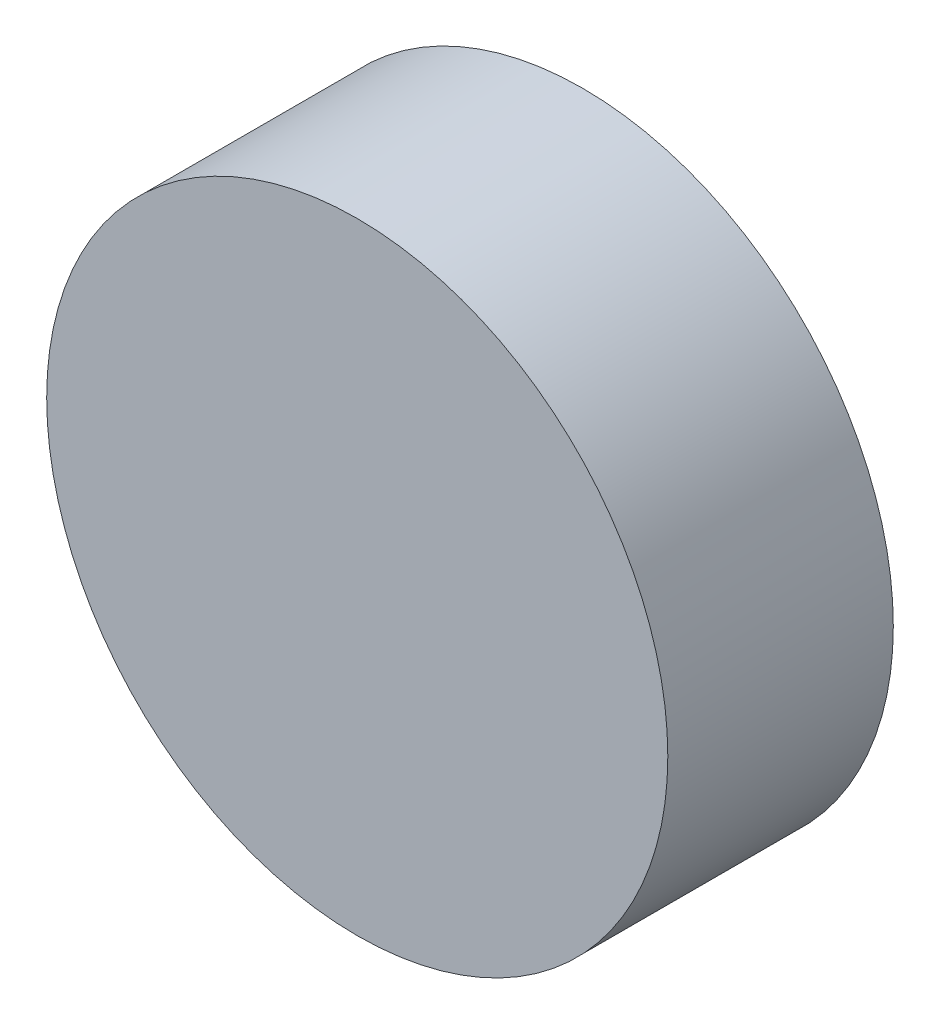
from build123d import *

# Parameters (mm, degrees)
SKETCH1_R           = 23
BOSS_EXTRUDE1_DEPTH = 16.7


with BuildPart() as part:
    # Sketch1 → Boss-Extrude1 (new body)
    with BuildSketch(Plane.XY):
        Circle(SKETCH1_R)
    extrude(amount=BOSS_EXTRUDE1_DEPTH)


solid = part.part
